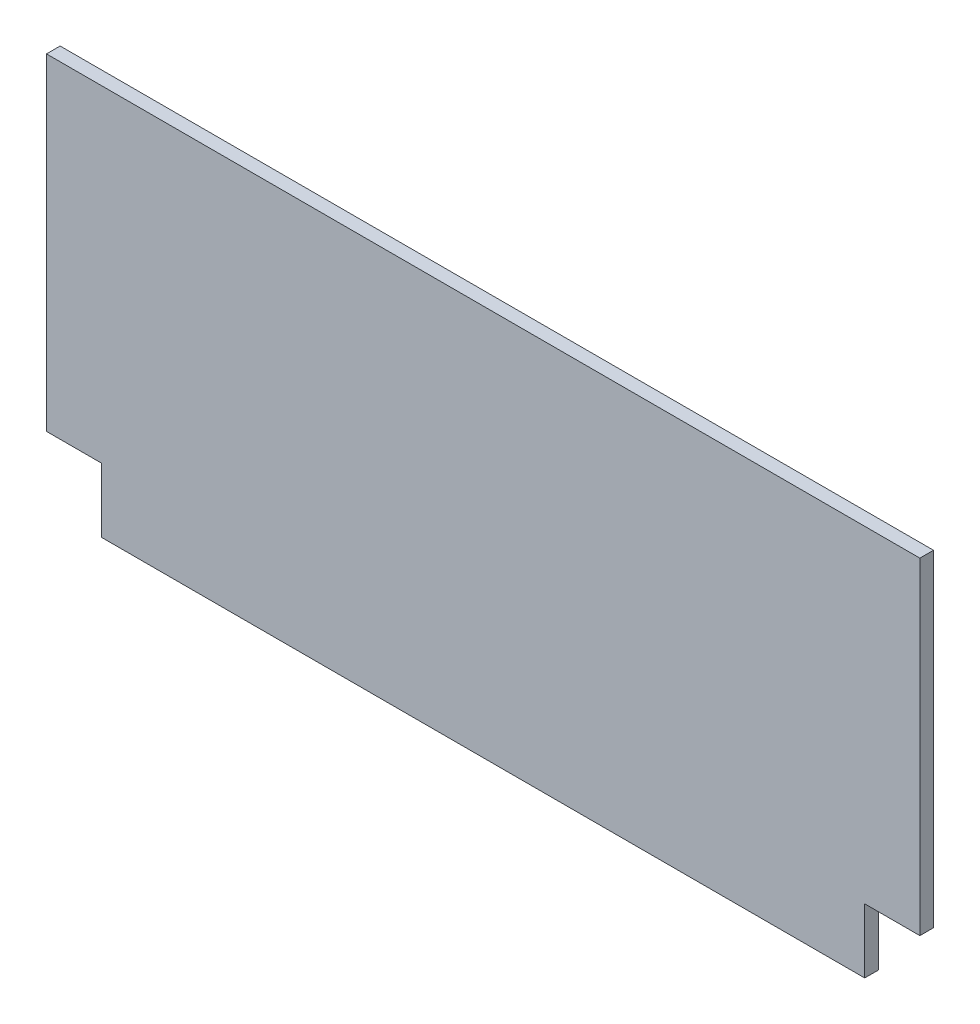
from build123d import *

# Parameters (mm, degrees)
SKETCH1_W           = 1219.2
SKETCH1_H           = 546.1
BOSS_EXTRUDE1_DEPTH = 19.05
SKETCH2_W           = 76.99375
SKETCH2_H           = 89.69375
CUT_EXTRUDE1_DEPTH  = 741.013427243


with BuildPart() as part:
    # Sketch1 → Boss-Extrude1 (new body)
    with BuildSketch(Plane.XY):
        with Locations((0, 146.05)):
            Rectangle(SKETCH1_W, SKETCH1_H)
    extrude(amount=BOSS_EXTRUDE1_DEPTH)

    # Sketch2 → Cut-Extrude1 (cut, through all)
    with BuildSketch(Plane(origin=(0, 0, 0), x_dir=(-1, 0, 0), z_dir=(0, 0, -1))):
        with Locations((-571.103125, -82.153125)):
            Rectangle(SKETCH2_W, SKETCH2_H)
        with Locations((571.103125, -82.153125)):
            Rectangle(SKETCH2_W, SKETCH2_H)
    extrude(amount=-CUT_EXTRUDE1_DEPTH, mode=Mode.SUBTRACT)


solid = part.part
